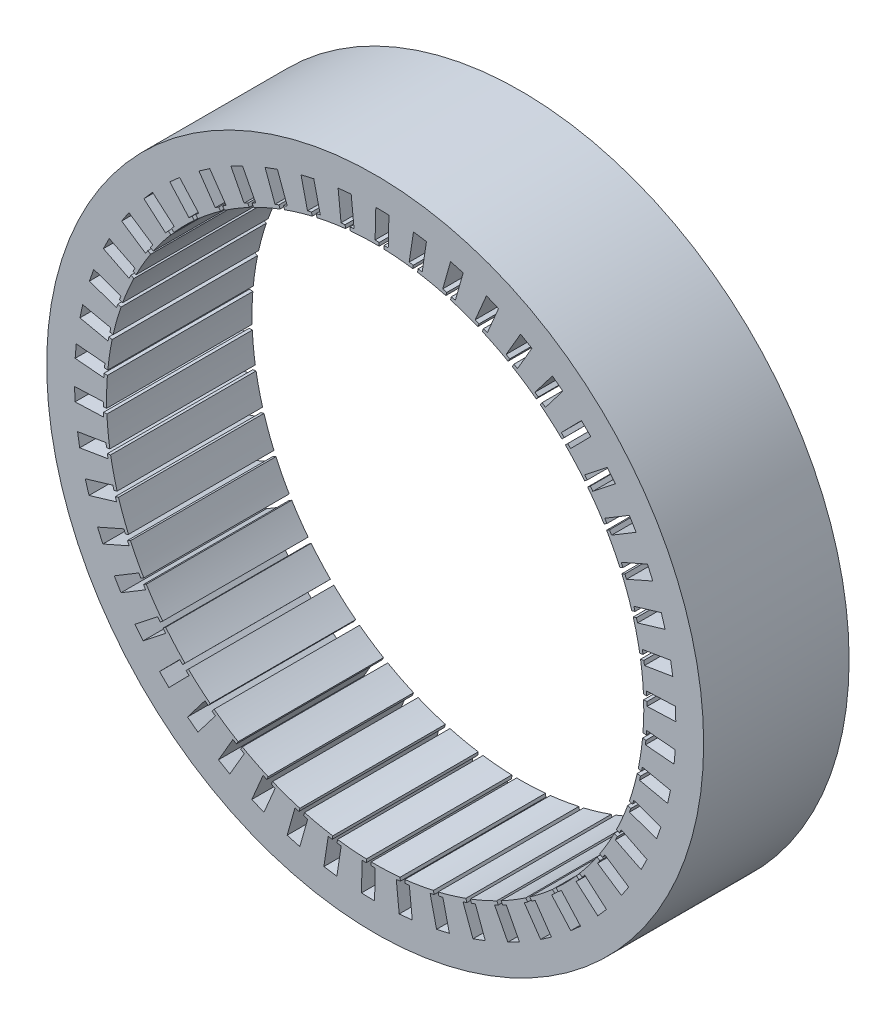
from build123d import *

# Parameters (mm, degrees)
ROTOR_STACK_START    = -15
SKETCH_1_R           = 67.753846154
SKETCH_1_R_2         = 55.4
ROTOR_STACK_DEPTH    = 30
ROTOR_50_SLOTS_DEPTH = 16


with BuildPart() as part:
    # Эскиз1 → Rotor_stack (new body)
    with BuildSketch(Plane.XY.offset(ROTOR_STACK_START)):
        Circle(SKETCH_1_R)
        Circle(SKETCH_1_R_2, mode=Mode.SUBTRACT)
    extrude(amount=ROTOR_STACK_DEPTH)

    # Эскиз2 → Rotor_50_slots (cut, symmetric)
    with BuildSketch(Plane.XY):
        Polygon((54.575761374, 1.626736139), (56.053851628, 1.684345397), (56.087105432, 0.831147038), (62.00568864, 1.061826581), (61.900235135, 3.767464618), (55.981651927, 3.536785076), (56.014905731, 2.683586718), (54.536815477, 2.62597746), align=None)
        Polygon((53.941531094, 8.454065486), (55.400745811, 8.696474309), (55.540671508, 7.854171481), (61.383673106, 8.824827218), (60.939944769, 11.495913662), (55.096943171, 10.525257926), (55.236868868, 9.682955098), (53.777654151, 9.440546276), align=None)
        Polygon((52.456610646, 15.14806917), (53.873937137, 15.571454625), (54.118328015, 14.753330947), (59.793600378, 16.448655058), (59.018595071, 19.043065281), (53.343322707, 17.34774117), (53.587713586, 16.529617492), (52.170387094, 16.106232037), align=None)
        Polygon((50.144418111, 21.603178754), (51.497504292, 22.200863801), (51.842506161, 21.419821571), (57.260546854, 23.813077781), (56.166486872, 26.289896384), (50.748446179, 23.896640174), (51.093448048, 23.115597944), (49.740361868, 22.517912897), align=None)
        Polygon((47.041418148, 27.717593304), (48.308925041, 28.480152092), (48.749097015, 27.748508814), (53.824460299, 30.801954043), (52.428599623, 33.122120116), (47.353236339, 30.068674886), (47.793408314, 29.337031608), (46.525901421, 28.57447282), align=None)
        Polygon((43.19654692, 33.39488485), (44.358485183, 34.310291372), (44.886885489, 33.639585496), (49.539529853, 37.30506509), (47.863882039, 39.431988228), (43.211237674, 35.766508634), (43.739637979, 35.095802758), (42.577699716, 34.180396237), align=None)
        Polygon((38.670440343, 38.545519113), (39.708485516, 39.59933686), (40.316780963, 39.000145819), (44.473331427, 43.219852975), (42.544322442, 45.11999033), (38.387771978, 40.900283174), (38.996067425, 40.301092133), (37.958022252, 39.247274386), align=None)
        Polygon((33.534477821, 43.088267513), (34.432259312, 44.263877151), (35.110856718, 43.745650546), (38.705761998, 48.45303796), (36.553813466, 50.096423231), (32.958908186, 45.389035817), (33.637505593, 44.870809211), (32.739724101, 43.695199574), align=None)
        Polygon((27.869656551, 46.951488195), (28.613015809, 48.230349657), (29.351213289, 47.801260231), (32.32777958, 52.922089592), (29.986829015, 54.282805611), (27.010262724, 49.16197625), (27.748460203, 48.732886823), (27.005100944, 47.454025361), align=None)
        Polygon((21.765314148, 50.074255861), (22.342527955, 51.436200738), (23.128683692, 51.103015487), (25.439968767, 56.556528258), (22.946934357, 57.61311572), (20.635649283, 52.15960295), (21.42180502, 51.826417699), (20.844591213, 50.464472822), align=None)
        Polygon((15.31771974, 52.407322599), (15.719685088, 53.830872206), (16.541400937, 53.598845661), (18.150954449, 59.299036687), (15.545152837, 60.034832578), (13.935599325, 54.334641552), (14.757315175, 54.102615007), (14.355349826, 52.679065399), align=None)
        Polygon((8.628555741, 53.913894553), (8.848933397, 55.376598663), (9.693250408, 55.249390021), (10.575688736, 61.106363884), (7.89821497, 61.509764263), (7.015776642, 55.6527904), (7.860093653, 55.525581758), (7.639715998, 54.062877647), align=None)
        Polygon((1.803314263, 54.570212183), (1.838628739, 56.049003079), (2.69223153, 56.028618496), (2.833638095, 61.95000722), (0.126717536, 62.014650221), (-0.01468903, 56.093261497), (0.83891376, 56.072876915), (0.803599284, 54.594086018), align=None)
        Polygon((-5.050366558, 54.365924968), (-5.200672191, 55.837481234), (-4.351245448, 55.924242187), (-4.953100712, 61.816661935), (-7.646778311, 61.5415281), (-7.044923047, 55.649108353), (-6.195496304, 55.735869306), (-6.045190671, 54.26431304), align=None)
        Polygon((-11.824400081, 53.30425464), (-12.157955415, 54.745368954), (-11.326100686, 54.937907172), (-12.661726162, 60.708430963), (-15.299679895, 60.097859317), (-13.96405442, 54.327335526), (-13.132199691, 54.519873744), (-12.798644357, 53.07875943), align=None)
        Polygon((-18.411955751, 51.401944374), (-18.923500419, 52.789889502), (-18.122336551, 53.085168542), (-20.170668626, 58.64279177), (-22.711296388, 57.706411392), (-20.662964312, 52.148788164), (-19.861800444, 52.444067204), (-19.350255777, 51.056122075), align=None)
        Polygon((-24.70914388, 48.688994739), (-25.390610516, 50.001881958), (-24.632772342, 50.395245093), (-27.361507597, 55.652320719), (-29.764742169, 54.404898888), (-27.036006914, 49.147823261), (-26.278168739, 49.541186396), (-25.596702103, 48.228299176), align=None)
        Polygon((-30.61665405, 45.208190572), (-31.457295519, 46.425314866), (-30.754734598, 46.910558523), (-34.120839249, 51.784179325), (-36.348780186, 50.245388628), (-32.982675536, 45.371767826), (-32.280114615, 45.857011484), (-31.439473147, 44.639887189), align=None)
        Polygon((-36.041321296, 41.014426233), (-37.027880179, 42.116592825), (-36.391676318, 42.686064423), (-40.342064882, 47.099370489), (-42.359576226, 45.293478574), (-38.409187662, 40.880172508), (-37.772983801, 41.449644107), (-36.786424918, 40.347477514), align=None)
        Polygon((-40.897595375, 36.173839892), (-42.01451305, 37.143666956), (-41.454699563, 37.788385588), (-45.927072053, 41.671776445), (-47.702336445, 39.627263306), (-43.229963954, 35.74387245), (-42.670150467, 36.388591081), (-41.553232793, 35.418764017), align=None)
        Polygon((-45.108889944, 30.762770486), (-46.338551951, 31.584963271), (-45.863957432, 32.294761338), (-50.787781862, 35.586993592), (-52.292802321, 33.336102424), (-47.368977891, 30.04387017), (-46.894383371, 30.753668237), (-45.664721364, 29.931475452), align=None)
        Polygon((-48.608790372, 24.866553813), (-49.931804207, 25.528145847), (-49.549913294, 26.29182941), (-54.847538012, 28.940982592), (-56.058579467, 26.519211292), (-50.760954749, 23.87005811), (-50.379063835, 24.633741674), (-49.05605, 23.97214964), align=None)
        Polygon((-51.342101138, 18.578176732), (-52.737602083, 19.068734313), (-52.454437424, 19.874259626), (-58.042315724, 21.838555008), (-58.940279327, 19.284096356), (-53.352401027, 17.319800975), (-53.069236368, 18.125326288), (-51.673735424, 17.634768707), align=None)
        Polygon((-53.265716299, 11.996810706), (-54.71169647, 12.308597448), (-54.531723741, 13.143260896), (-60.321731443, 14.391720365), (-60.892455772, 11.744859702), (-55.10244807, 10.496400232), (-54.922475342, 11.33106368), (-53.476495171, 11.019276938), align=None)
        Polygon((-54.349299295, 5.226247808), (-55.822954721, 5.354346648), (-55.7490122, 6.204985089), (-61.649837424, 6.717919696), (-61.884321815, 4.020399593), (-55.983496591, 3.507464987), (-55.90955407, 4.358103428), (-54.435898644, 4.230004589), align=None)
        Polygon((-54.575761374, -1.626736139), (-56.053851628, -1.684345397), (-56.087105432, -0.831147038), (-62.00568864, -1.061826581), (-61.900235135, -3.767464618), (-55.981651927, -3.536785076), (-56.014905731, -2.683586718), (-54.536815477, -2.62597746), align=None)
        Polygon((-53.941531094, -8.454065486), (-55.400745811, -8.696474309), (-55.540671508, -7.854171481), (-61.383673106, -8.824827218), (-60.939944769, -11.495913662), (-55.096943171, -10.525257926), (-55.236868868, -9.682955098), (-53.777654151, -9.440546276), align=None)
        Polygon((-52.456610646, -15.14806917), (-53.873937137, -15.571454625), (-54.118328015, -14.753330947), (-59.793600378, -16.448655058), (-59.018595071, -19.043065281), (-53.343322707, -17.34774117), (-53.587713586, -16.529617492), (-52.170387094, -16.106232037), align=None)
        Polygon((-50.144418111, -21.603178754), (-51.497504292, -22.200863801), (-51.842506161, -21.419821571), (-57.260546854, -23.813077781), (-56.166486872, -26.289896384), (-50.748446179, -23.896640174), (-51.093448048, -23.115597944), (-49.740361868, -22.517912897), align=None)
        Polygon((-47.041418148, -27.717593304), (-48.308925041, -28.480152092), (-48.749097015, -27.748508814), (-53.824460299, -30.801954043), (-52.428599623, -33.122120116), (-47.353236339, -30.068674886), (-47.793408314, -29.337031608), (-46.525901421, -28.57447282), align=None)
        Polygon((-43.19654692, -33.39488485), (-44.358485183, -34.310291372), (-44.886885489, -33.639585496), (-49.539529853, -37.30506509), (-47.863882039, -39.431988228), (-43.211237674, -35.766508634), (-43.739637979, -35.095802758), (-42.577699716, -34.180396237), align=None)
        Polygon((-38.670440343, -38.545519113), (-39.708485516, -39.59933686), (-40.316780963, -39.000145819), (-44.473331427, -43.219852975), (-42.544322442, -45.11999033), (-38.387771978, -40.900283174), (-38.996067425, -40.301092133), (-37.958022252, -39.247274386), align=None)
        Polygon((-33.534477821, -43.088267513), (-34.432259312, -44.263877151), (-35.110856718, -43.745650546), (-38.705761998, -48.45303796), (-36.553813466, -50.096423231), (-32.958908186, -45.389035817), (-33.637505593, -44.870809211), (-32.739724101, -43.695199574), align=None)
        Polygon((-27.869656551, -46.951488195), (-28.613015809, -48.230349657), (-29.351213289, -47.801260231), (-32.32777958, -52.922089592), (-29.986829015, -54.282805611), (-27.010262724, -49.16197625), (-27.748460203, -48.732886823), (-27.005100944, -47.454025361), align=None)
        Polygon((-21.765314148, -50.074255861), (-22.342527955, -51.436200738), (-23.128683692, -51.103015487), (-25.439968767, -56.556528258), (-22.946934357, -57.61311572), (-20.635649283, -52.15960295), (-21.42180502, -51.826417699), (-20.844591213, -50.464472822), align=None)
        Polygon((-15.31771974, -52.407322599), (-15.719685088, -53.830872206), (-16.541400937, -53.598845661), (-18.150954449, -59.299036687), (-15.545152837, -60.034832578), (-13.935599325, -54.334641552), (-14.757315175, -54.102615007), (-14.355349826, -52.679065399), align=None)
        Polygon((-8.628555741, -53.913894553), (-8.848933397, -55.376598663), (-9.693250408, -55.249390021), (-10.575688736, -61.106363884), (-7.89821497, -61.509764263), (-7.015776642, -55.6527904), (-7.860093653, -55.525581758), (-7.639715998, -54.062877647), align=None)
        Polygon((-1.803314263, -54.570212183), (-1.838628739, -56.049003079), (-2.69223153, -56.028618496), (-2.833638095, -61.95000722), (-0.126717536, -62.014650221), (0.01468903, -56.093261497), (-0.83891376, -56.072876915), (-0.803599284, -54.594086018), align=None)
        Polygon((5.050366558, -54.365924968), (5.200672191, -55.837481234), (4.351245448, -55.924242187), (4.953100712, -61.816661935), (7.646778311, -61.5415281), (7.044923047, -55.649108353), (6.195496304, -55.735869306), (6.045190671, -54.26431304), align=None)
        Polygon((11.824400081, -53.30425464), (12.157955415, -54.745368954), (11.326100686, -54.937907172), (12.661726162, -60.708430963), (15.299679895, -60.097859317), (13.96405442, -54.327335526), (13.132199691, -54.519873744), (12.798644357, -53.07875943), align=None)
        Polygon((18.411955751, -51.401944374), (18.923500419, -52.789889502), (18.122336551, -53.085168542), (20.170668626, -58.64279177), (22.711296388, -57.706411392), (20.662964312, -52.148788164), (19.861800444, -52.444067204), (19.350255777, -51.056122075), align=None)
        Polygon((24.70914388, -48.688994739), (25.390610516, -50.001881958), (24.632772342, -50.395245093), (27.361507597, -55.652320719), (29.764742169, -54.404898888), (27.036006914, -49.147823261), (26.278168739, -49.541186396), (25.596702103, -48.228299176), align=None)
        Polygon((30.61665405, -45.208190572), (31.457295519, -46.425314866), (30.754734598, -46.910558523), (34.120839249, -51.784179325), (36.348780186, -50.245388628), (32.982675536, -45.371767826), (32.280114615, -45.857011484), (31.439473147, -44.639887189), align=None)
        Polygon((36.041321296, -41.014426233), (37.027880179, -42.116592825), (36.391676318, -42.686064423), (40.342064882, -47.099370489), (42.359576226, -45.293478574), (38.409187662, -40.880172508), (37.772983801, -41.449644107), (36.786424918, -40.347477514), align=None)
        Polygon((40.897595375, -36.173839892), (42.01451305, -37.143666956), (41.454699563, -37.788385588), (45.927072053, -41.671776445), (47.702336445, -39.627263306), (43.229963954, -35.74387245), (42.670150467, -36.388591081), (41.553232793, -35.418764017), align=None)
        Polygon((45.108889944, -30.762770486), (46.338551951, -31.584963271), (45.863957432, -32.294761338), (50.787781862, -35.586993592), (52.292802321, -33.336102424), (47.368977891, -30.04387017), (46.894383371, -30.753668237), (45.664721364, -29.931475452), align=None)
        Polygon((48.608790372, -24.866553813), (49.931804207, -25.528145847), (49.549913294, -26.29182941), (54.847538012, -28.940982592), (56.058579467, -26.519211292), (50.760954749, -23.87005811), (50.379063835, -24.633741674), (49.05605, -23.97214964), align=None)
        Polygon((51.342101138, -18.578176732), (52.737602083, -19.068734313), (52.454437424, -19.874259626), (58.042315724, -21.838555008), (58.940279327, -19.284096356), (53.352401027, -17.319800975), (53.069236368, -18.125326288), (51.673735424, -17.634768707), align=None)
        Polygon((53.265716299, -11.996810706), (54.71169647, -12.308597448), (54.531723741, -13.143260896), (60.321731443, -14.391720365), (60.892455772, -11.744859702), (55.10244807, -10.496400232), (54.922475342, -11.33106368), (53.476495171, -11.019276938), align=None)
        Polygon((54.349299295, -5.226247808), (55.822954721, -5.354346648), (55.7490122, -6.204985089), (61.649837424, -6.717919696), (61.884321815, -4.020399593), (55.983496591, -3.507464987), (55.90955407, -4.358103428), (54.435898644, -4.230004589), align=None)
    extrude(amount=ROTOR_50_SLOTS_DEPTH, both=True, mode=Mode.SUBTRACT)


solid = part.part
